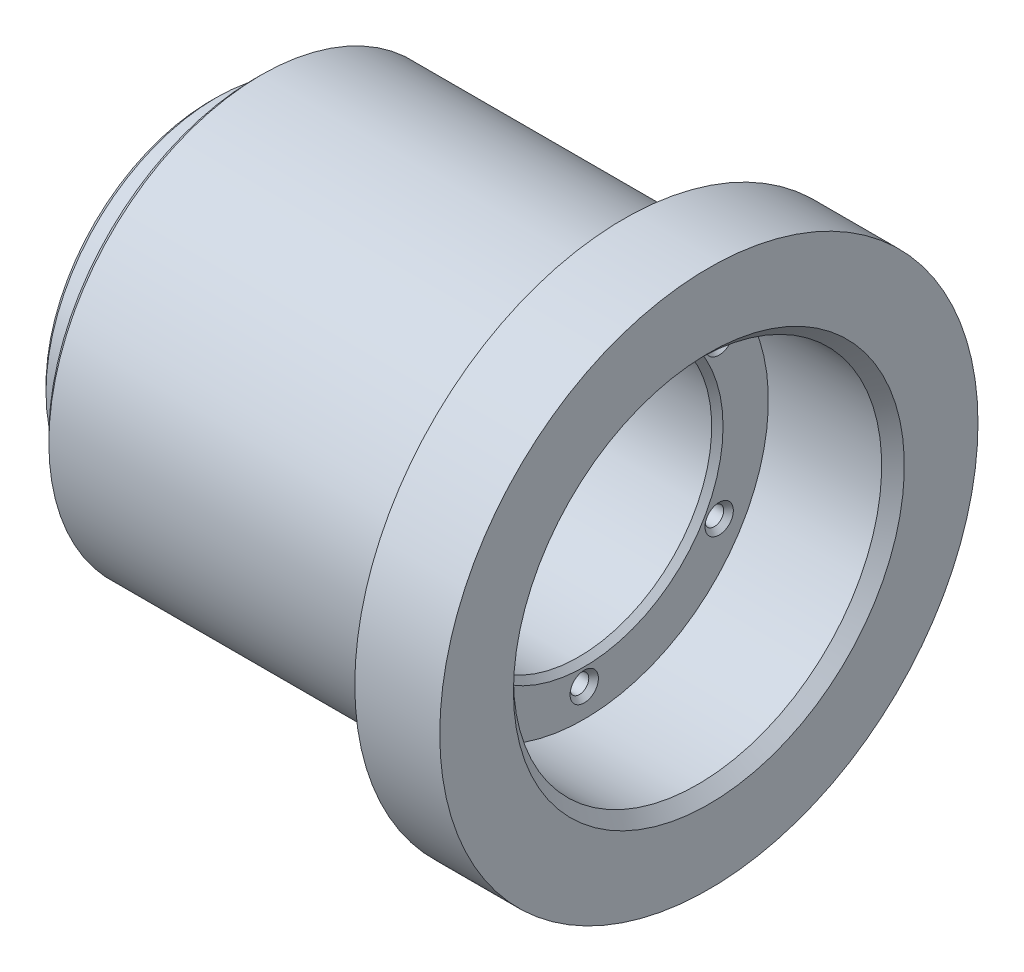
from build123d import *

# Parameters (mm, degrees)
HOLE_WIZARD_M61_D        = 5
HOLE_WIZARD_M61_DEPTH    = 18
HOLE_WIZARD_M61_TIP      = 1.502151548
CHAMFER_2_SIZE           = 1
SKETCH_12_R              = 18
SKETCH_12_R_2            = 15
CUT_EXTRUDE_1_DEPTH      = 4
SKETCH_11_W              = 65
SKETCH_11_H              = 10
PATTERN_CIRCULAR_1_COUNT = 6
CHAMFER_3_SIZE           = 5
CHAMFER_4_SIZE           = 2
CHAMFER_5_SIZE           = 1


with BuildPart() as part:
    # Эскиз1 → Повернуть1 (revolve)
    with BuildSketch(Plane.XY, mode=Mode.PRIVATE) as revolve_1_sk:
        Polygon((-48, 15), (-48, 30), (-40, 30), (-40, 47.5), (40, 47.5), (40, 32.5), (18, 32.5), (18, 23.5), (-18, 23.5), (-18, 21), (-21, 21), (-21, 15), align=None)
    revolve(revolve_1_sk.sketch.rotate(Axis((0, 0, 0), (1, 0, 0)), 90), axis=Axis((0, 0, 0), (1, 0, 0)))

    # Отверстие обработанное метчиком M61
    with Locations(Plane.ZY.offset(48)):
        with Locations((0, 24), (20.784609691, 12), (20.784609691, -12), (0, -24), (-20.784609691, -12), (-20.784609691, 12)):
            Hole(HOLE_WIZARD_M61_D / 2, depth=HOLE_WIZARD_M61_DEPTH)
            with Locations((0, 0, -(HOLE_WIZARD_M61_DEPTH + HOLE_WIZARD_M61_TIP / 2))):  # 118° drill point
                Cone(0, HOLE_WIZARD_M61_D / 2, HOLE_WIZARD_M61_TIP, mode=Mode.SUBTRACT)

    # Эскиз10 → Отверстие обработанное метчиком M44 (revolve, cut)
    with BuildSketch(Plane(origin=(18, 27.5, 0), x_dir=(0, 0, -1), z_dir=(0, 1, 0))):
        Polygon((0, 0), (0, 16.991420021), (1.65, 16), (1.65, 0.85), (2.5, 0), align=None)
    hole_wizard_m44 = revolve(axis=Axis((24.35, 27.5, 0), (-1, 0, 0)), mode=Mode.SUBTRACT)

    # Фаска2
    chamfer_2_edges = [part.edges().sort_by_distance(p)[0] for p in [
        (-48, 12, -18.284609691),
        (-48, -12, -18.284609691),
        (-48, -24, 2.5),
        (-48, -12, 23.284609691),
        (-48, 12, 23.284609691),
        (-48, 24, 2.5),
    ]]
    chamfer(chamfer_2_edges, length=CHAMFER_2_SIZE)

    # Эскиз12 → Вырез-Вытянуть1 (cut)
    with BuildSketch(Plane.ZY.offset(48)):
        Circle(SKETCH_12_R)
        Circle(SKETCH_12_R_2, mode=Mode.SUBTRACT)
    extrude(amount=-CUT_EXTRUDE_1_DEPTH, mode=Mode.SUBTRACT)

    # Эскиз11 → Вырез-Повернуть1 (revolve, cut)
    with BuildSketch(Plane.XY, mode=Mode.PRIVATE) as cut_revolve_1_sk:
        with Locations((-7.5, 42.5)):
            Rectangle(SKETCH_11_W, SKETCH_11_H)
    revolve(cut_revolve_1_sk.sketch.rotate(Axis((0, 0, 0), (-1, 0, 0)), 270), axis=Axis((0, 0, 0), (-1, 0, 0)), mode=Mode.SUBTRACT)

    # Круговой массив1: Отверстие обработанное метчиком M44 ×6 about axis
    pattern_circular_1_axis = Axis((0, 0, 0), (1, 0, 0))
    for i in range(1, PATTERN_CIRCULAR_1_COUNT):
        add(hole_wizard_m44.rotate(pattern_circular_1_axis, i * 360 / PATTERN_CIRCULAR_1_COUNT), mode=Mode.SUBTRACT)

    # Фаска3
    chamfer_3_edges = [part.edges().sort_by_distance(p)[0] for p in [
        (25, 0, -37.5),
    ]]
    chamfer(chamfer_3_edges, length=CHAMFER_3_SIZE)

    # Фаска4
    chamfer_4_edges = [part.edges().sort_by_distance(p)[0] for p in [
        (40, 0, -32.5),
    ]]
    chamfer(chamfer_4_edges, length=CHAMFER_4_SIZE)

    # Фаска5
    chamfer_5_edges = [part.edges().sort_by_distance(p)[0] for p in [
        (18, 0, -23.5),
        (-44, 0, -15),
        (-48, 0, -18),
        (-40, 0, -37.5),
        (-48, 0, -30),
    ]]
    chamfer(chamfer_5_edges, length=CHAMFER_5_SIZE)


solid = part.part
